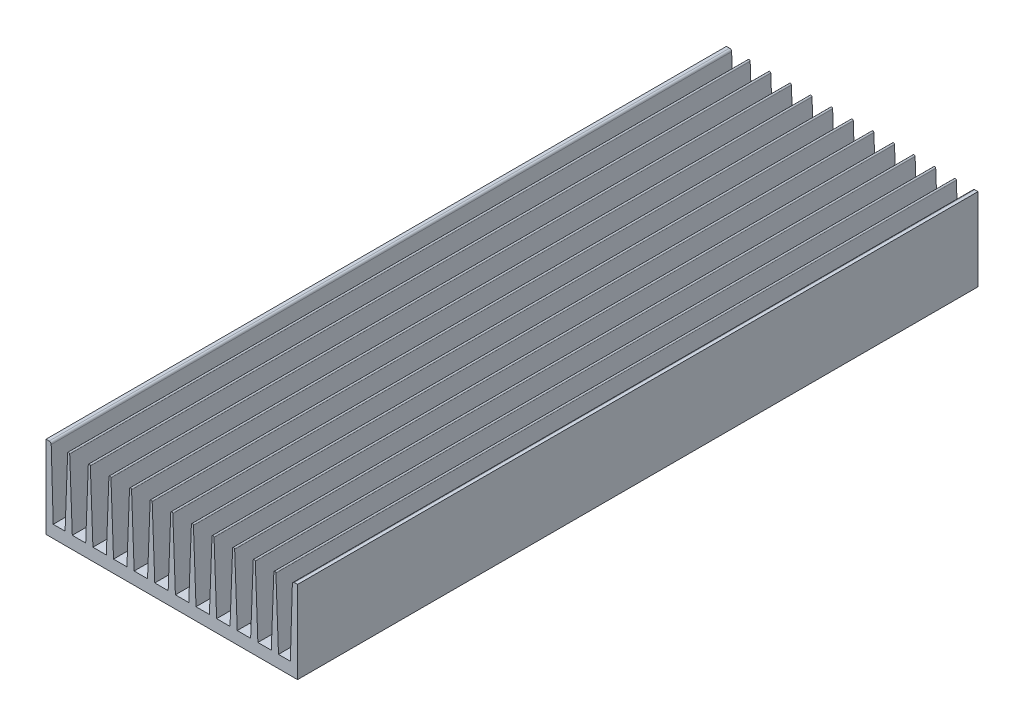
from build123d import *

# Parameters (mm, degrees)
EXTRUDE_1_DEPTH       = 330
EXTRUDE_3_DEPTH       = 330
PATTERN_CURVE_1_COUNT = 11
PATTERN_CURVE_1_PITCH = 10
SKETCH_3_R            = 2.25
CUT_EXTRUDE_1_DEPTH   = 6
SKETCH_4_R            = 1.6
SKETCH_4_R_2          = 2.1
SKETCH_4_R_3          = 2.5
SKETCH_4_R_4          = 2.6
SKETCH_4_R_5          = 1.1
CUT_EXTRUDE_2_DEPTH   = 6


with BuildPart() as part:
    # Эскиз1 → Вытянуть1 (new body)
    with BuildSketch(Plane.XY):
        with BuildLine():
            Line((0, 40), (1.528979332, 40))
            ThreePointArc((1.528979332, 40), (2.225614441, 39.717425624), (2.528547087, 39.029399052))
            Line((2.528547087, 39.029399052), (3.5, 6))
            Line((3.5, 6), (118.5, 6))
            Line((118.5, 6), (119.471452913, 39.029399052))
            ThreePointArc((119.471452913, 39.029399052), (119.774385559, 39.717425624), (120.471020668, 40))
            Line((120.471020668, 40), (122, 40))
            Line((122, 40), (122, 0))
            Line((122, 0), (0, 0))
            Line((0, 0), (0, 40))
        make_face()
    extrude(amount=EXTRUDE_1_DEPTH)

    # Эскиз2 → Вытянуть3 (add)
    with BuildSketch(Plane.XY.offset(330)):
        with BuildLine():
            Line((10.5, 39.5), (9.25, 6))
            Line((9.25, 6), (12.75, 6))
            Line((12.75, 6), (11.5, 39.5))
            ThreePointArc((11.5, 39.5), (11, 40), (10.5, 39.5))
        make_face()
    extrude_3 = extrude(amount=-EXTRUDE_3_DEPTH)

    # Кривая1: Вытянуть3 ×11
    with Locations(*[(i * PATTERN_CURVE_1_PITCH, 0, 0) for i in range(1, PATTERN_CURVE_1_COUNT)]):
        add(extrude_3)

    # Эскиз3 → Вырез-Вытянуть1 (cut)
    with BuildSketch(Plane.XZ):
        with Locations((28, 322)):
            Circle(SKETCH_3_R)
        with Locations((94, 322)):
            Circle(SKETCH_3_R)
        with Locations(Location((94, 8, 0), (0, 0, 236.251011404))):
            Circle(SKETCH_3_R)
        with Locations(Location((28, 8, 0), (0, 0, 56.251011404))):
            Circle(SKETCH_3_R)
    extrude(amount=-CUT_EXTRUDE_1_DEPTH, mode=Mode.SUBTRACT)

    # Эскиз4 → Вырез-Вытянуть2 (cut)
    with BuildSketch(Plane(origin=(1.487985642, 0, 27.400529356), x_dir=(1, 0, 0), z_dir=(0, -1, 0))):
        with Locations((75.912014358, 233.599470644)):
            Circle(SKETCH_4_R)
        with Locations((59.512014358, 123.599470644)):
            Circle(SKETCH_4_R)
        with Locations((75.912014358, 200.099470644)):
            Circle(SKETCH_4_R)
        with Locations((28.512014358, 276.599470644)):
            Circle(SKETCH_4_R)
        with Locations((28.512014358, 156.599470644)):
            Circle(SKETCH_4_R)
        with Locations((59.512014358, 13.599470644)):
            Circle(SKETCH_4_R)
        with Locations((38.512014358, 113.599470644)):
            Circle(SKETCH_4_R_2)
        with Locations((65.832014358, 79.479470644)):
            Circle(SKETCH_4_R_3)
        with Locations((100.512014358, 251.599470644)):
            Circle(SKETCH_4_R_4)
        with Locations((85.842014358, 140.399470644)):
            Circle(SKETCH_4_R_5)
    extrude(amount=-CUT_EXTRUDE_2_DEPTH, mode=Mode.SUBTRACT)


solid = part.part
